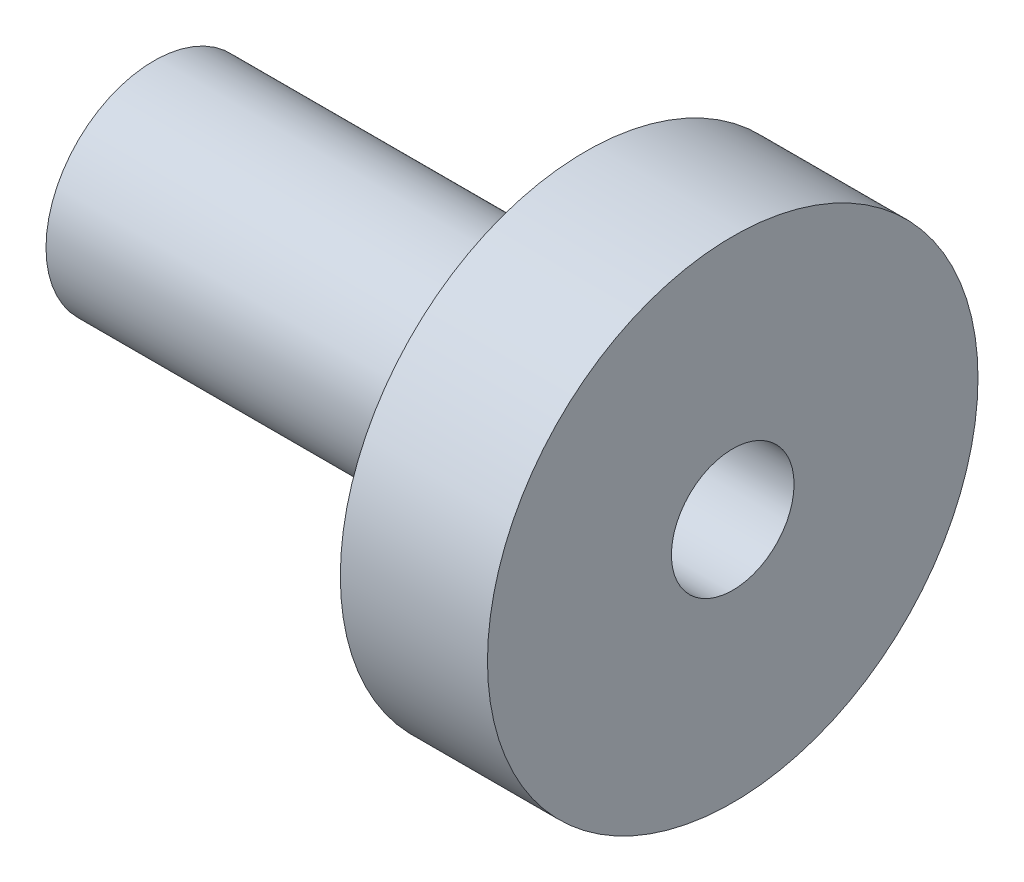
from build123d import *


with BuildPart() as part:
    # Sketch1 → Revolve2 (revolve)
    with BuildSketch(Plane.XY, mode=Mode.PRIVATE) as revolve2_sk:
        Polygon((0, 0), (0, 6.35), (-3.81, 6.35), (-3.81, 2.794), (-14.986, 2.794), (-14.986, 0), align=None)
    revolve(revolve2_sk.sketch.rotate(Axis((-1364.978742306, 0, 0), (1, 0, 0)), 90), axis=Axis((-1364.978742306, 0, 0), (1, 0, 0)))

    # Sketch4 → Cut-Revolve1 (revolve, cut)
    with BuildSketch(Plane.XY, mode=Mode.PRIVATE) as cut_revolve1_sk:
        Polygon((0, 0), (0, 1.5875), (-2.54, 1.5875), (-3.493866233, 0), align=None)
    revolve(cut_revolve1_sk.sketch.rotate(Axis((0, 0, 0), (-1, 0, 0)), 90), axis=Axis((0, 0, 0), (-1, 0, 0)), mode=Mode.SUBTRACT)


solid = part.part
